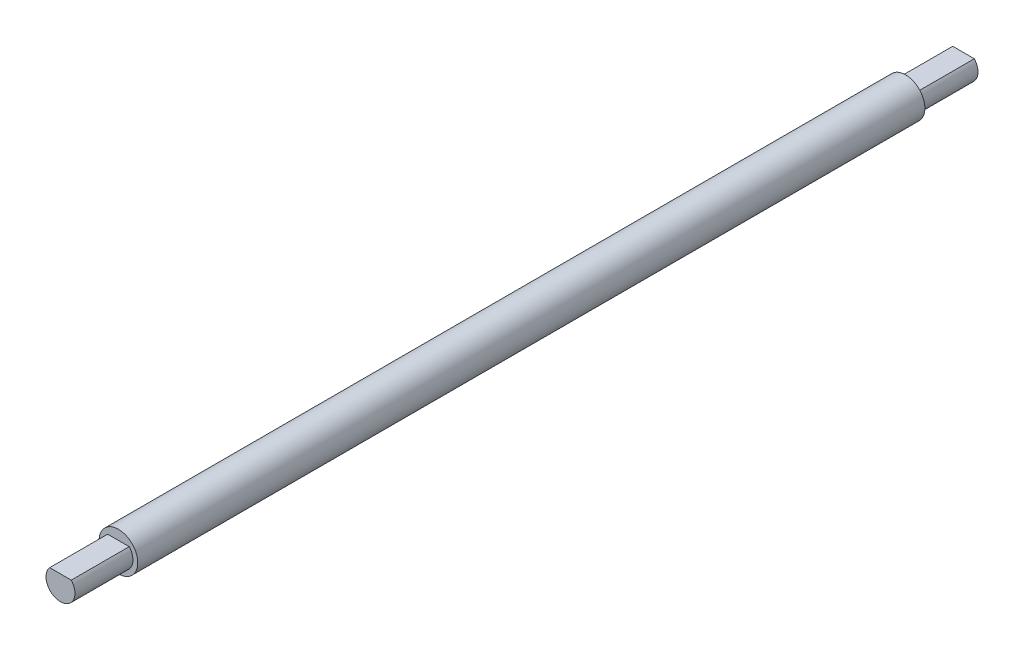
from build123d import *

# Parameters (mm, degrees)
ESBO_O1_R                  = 6.35
RESSALTO_EXTRUS_O1_DEPTH   = 187
ESBO_O2_R                  = 12.7
ESBO_O2_R_2                = 4
CORTE_EXTRUS_O1_DEPTH      = 188.215504166
CORTE_EXTRUS_O2_DEPTH      = 188.085541932
CORTE_EXTRUS_O2_DEPTH_BACK = 188.085541932
ESBO_O3_W                  = 12
ESBO_O3_H                  = 10
ESBO_O5_W                  = 12
ESBO_O5_H                  = 10


with BuildPart() as part:
    # Esboço1 → Ressalto-extrusão1 (new body)
    with BuildSketch(Plane.XY):
        Circle(ESBO_O1_R)
    extrude(amount=RESSALTO_EXTRUS_O1_DEPTH)

    # Esboço2 → Corte-extrusão1 (cut, through all)
    with BuildSketch(Plane.XY.offset(187)):
        Circle(ESBO_O2_R)
        Circle(ESBO_O2_R_2, mode=Mode.SUBTRACT)
    extrude(amount=-CORTE_EXTRUS_O1_DEPTH, mode=Mode.SUBTRACT)

    # Esboço3 → Corte-extrusão2 (cut, two sides: drawn at the far end of the back side and taken through both)
    with BuildSketch(Plane(origin=(0, 0, 0), x_dir=(0, 0, -1), z_dir=(1, 0, 0)).offset(-CORTE_EXTRUS_O2_DEPTH_BACK)):
        with Locations((-181, 7)):
            Rectangle(ESBO_O3_W, ESBO_O3_H)
        with Locations((-6, 7)):
            Rectangle(ESBO_O3_W, ESBO_O3_H)
    extrude(amount=CORTE_EXTRUS_O2_DEPTH + CORTE_EXTRUS_O2_DEPTH_BACK, mode=Mode.SUBTRACT)

    # Esboço5 → Corte-Revolução2 (revolve, cut)
    with BuildSketch(Plane(origin=(0, 0, 0), x_dir=(0, 0, -1), z_dir=(1, 0, 0))):
        with Locations((-181, 8)):
            Rectangle(ESBO_O5_W, ESBO_O5_H)
        with Locations((-6, 8)):
            Rectangle(ESBO_O5_W, ESBO_O5_H)
    revolve(axis=Axis((0, 0, 0), (0, 0, 1)), mode=Mode.SUBTRACT)


solid = part.part
